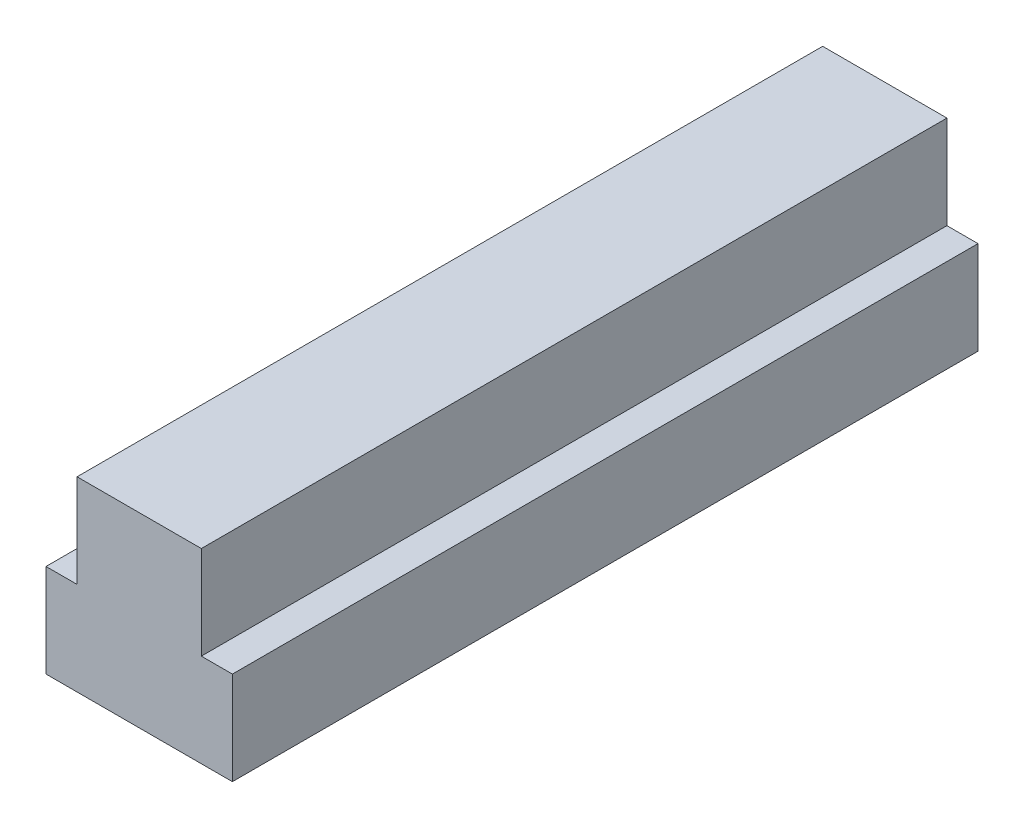
from build123d import *

# Parameters (mm, degrees)
BOSS_EXTRUDE1_DEPTH = 19.05


with BuildPart() as part:
    # Sketch1 → Boss-Extrude1 (new body)
    with BuildSketch(Plane.XY):
        Polygon((2.38125, -1.190625), (2.38125, 1.190625), (1.5875, 1.190625), (1.5875, 3.571875), (-1.5875, 3.571875), (-1.5875, 1.190625), (-2.38125, 1.190625), (-2.38125, -1.190625), align=None)
    extrude(amount=BOSS_EXTRUDE1_DEPTH)


solid = part.part
